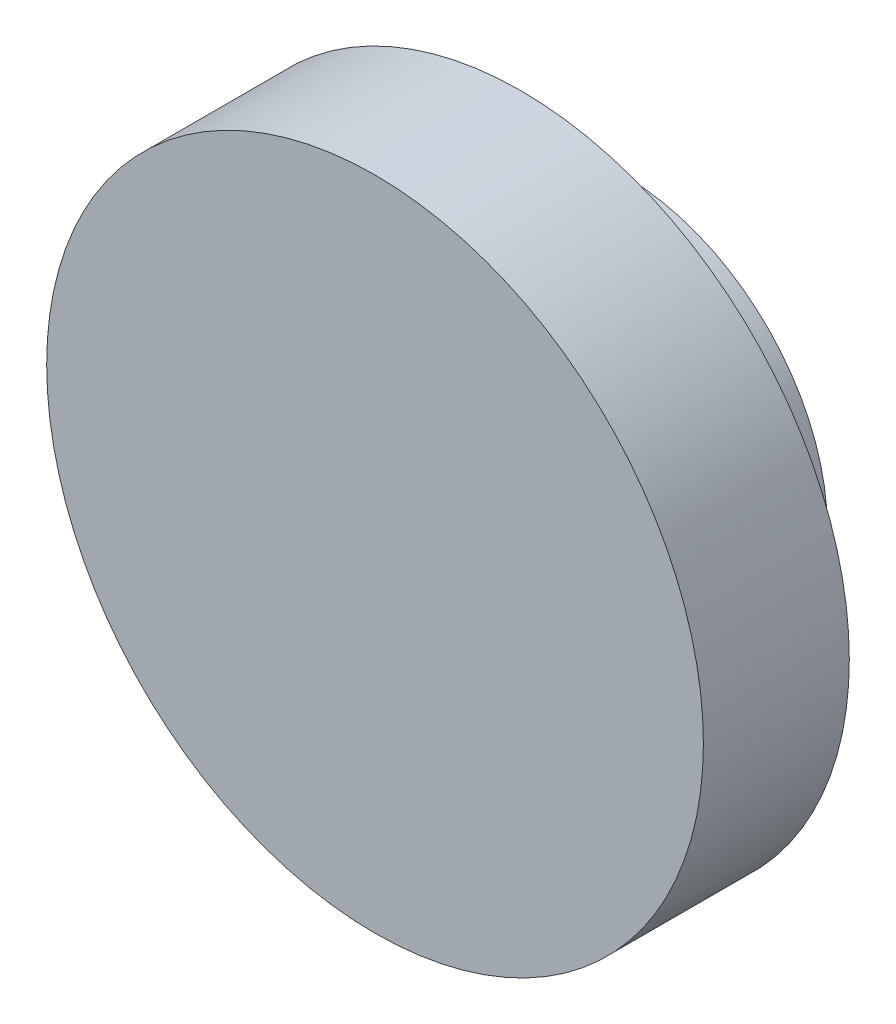
from build123d import *

# Parameters (mm, degrees)
SKETCH_1_R      = 14
SKETCH_1_R_2    = 12.25
EXTRUDE_1_DEPTH = 3
SKETCH_2_R      = 15.963029432
SKETCH_2_R_2    = 12.25
EXTRUDE_2_DEPTH = 1
SKETCH_3_R      = 22.5
EXTRUDE_3_DEPTH = 10


with BuildPart() as part:
    # 草图1 → 凸台-拉伸1 (new, symmetric)
    with BuildSketch(Plane.XY):
        Circle(SKETCH_1_R)
        Circle(SKETCH_1_R_2, mode=Mode.SUBTRACT)
    extrude(amount=EXTRUDE_1_DEPTH, both=True)

    # 草图2 → 凸台-拉伸2 (add)
    with BuildSketch(Plane.XY.offset(3)):
        Circle(SKETCH_2_R)
        Circle(SKETCH_2_R_2, mode=Mode.SUBTRACT)
    extrude(amount=EXTRUDE_2_DEPTH)

    # 草图3 → 凸台-拉伸3 (add)
    with BuildSketch(Plane.XY.offset(4)):
        Circle(SKETCH_3_R)
    extrude(amount=EXTRUDE_3_DEPTH)


solid = part.part
